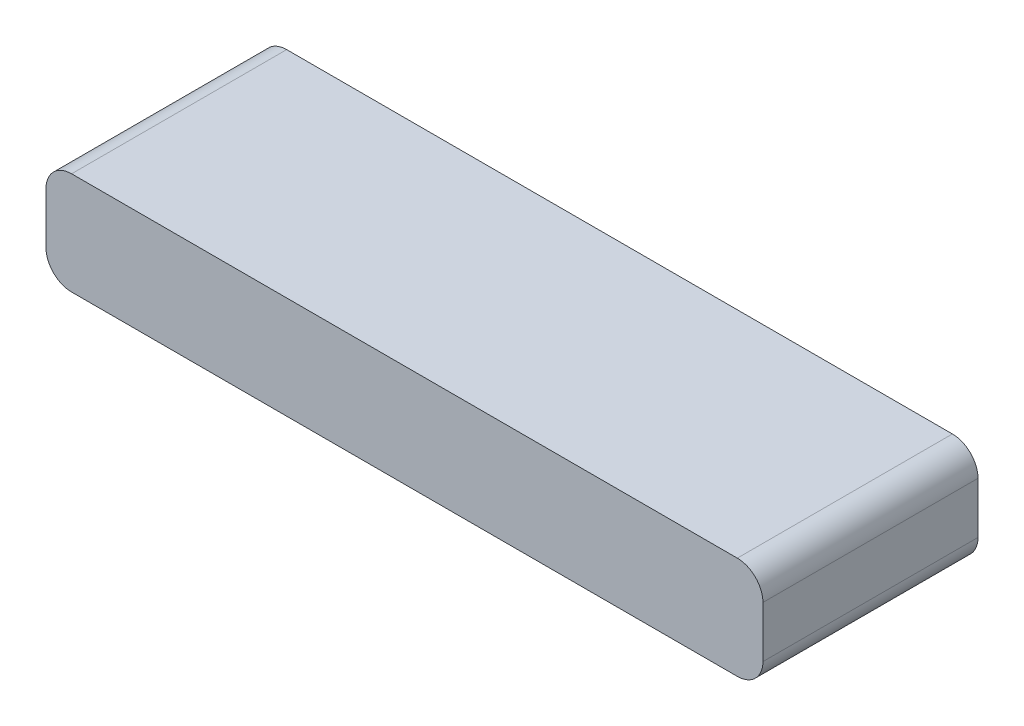
from build123d import *

# Parameters (mm, degrees)
SKETCH_1_W      = 140
SKETCH_1_H      = 42
EXTRUDE_1_DEPTH = 20
SKETCH_2_W      = 21.145082228
SKETCH_2_H      = 7.433476263
EXTRUDE_2_DEPTH = 4
FILLET_1_R      = 5
FILLET_2_R      = 5


with BuildPart() as part:
    # 草图1 → 凸台-拉伸1 (new body)
    with BuildSketch(Plane(origin=(0, 0, 0), x_dir=(1, 0, 0), z_dir=(0, 1, 0))):
        Rectangle(SKETCH_1_W, SKETCH_1_H)
    extrude(amount=EXTRUDE_1_DEPTH)

    # 草图2 → 凸台-拉伸2 (add)
    with BuildSketch(Plane.XZ):
        with Locations((0, 8.716738132)):
            Rectangle(SKETCH_2_W, SKETCH_2_H)
    extrude(amount=EXTRUDE_2_DEPTH)

    # 圆角1
    fillet_1_edges = [part.edges().sort_by_distance(p)[0] for p in [
        (-70, 20, 0),
        (70, 20, 0),
    ]]
    fillet(fillet_1_edges, radius=FILLET_1_R)

    # 圆角2
    fillet_2_edges = [part.edges().sort_by_distance(p)[0] for p in [
        (-70, 0, 0),
        (70, 0, 0),
    ]]
    fillet(fillet_2_edges, radius=FILLET_2_R)


solid = part.part
